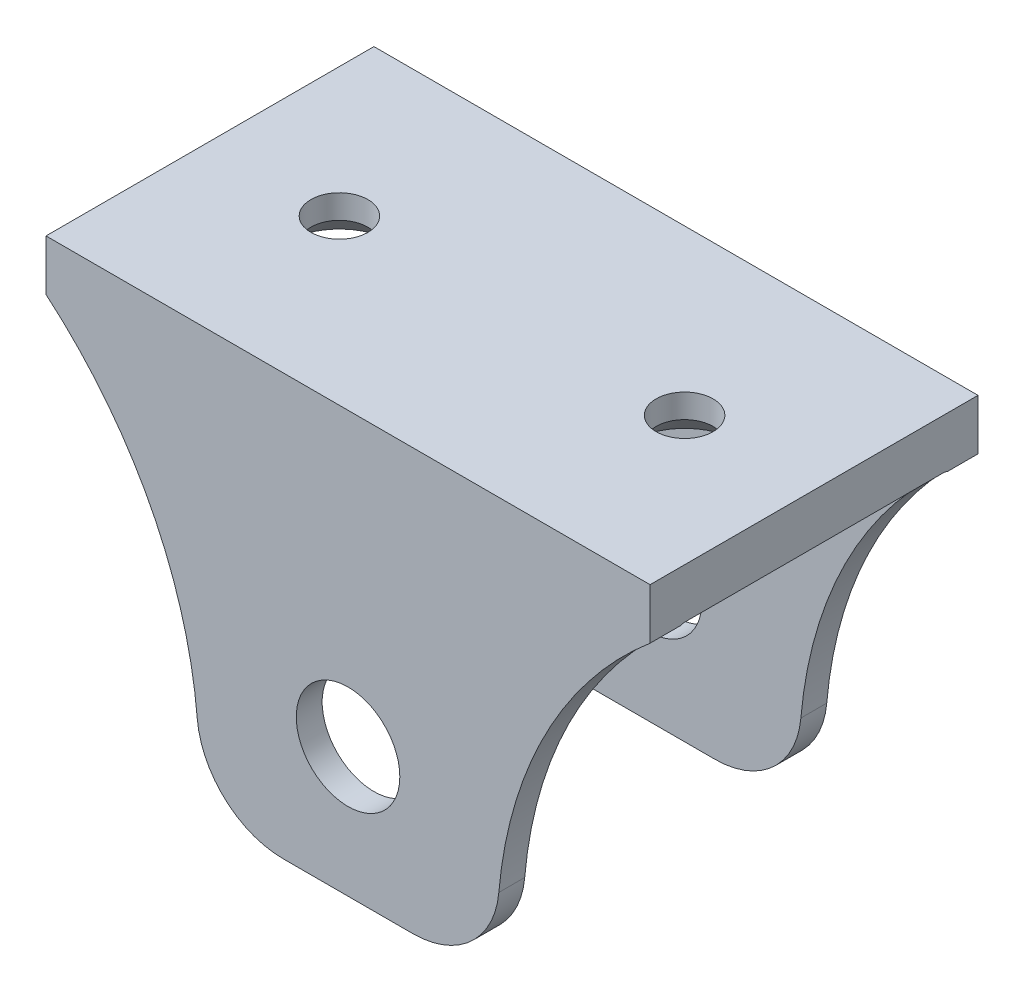
from build123d import *

# Parameters (mm, degrees)
SZKIC1_R                                 = 6
DODANIE_WYCI_GNI_CIE1_DEPTH              = 38
SZKIC2_W                                 = 70
SZKIC2_H                                 = 32
WYTNIJ_WYCI_GNI_CIE1_DEPTH               = 43
ZAOKR_GLENIE1_R                          = 1
POG_BIENIE_STO_KOWE_POD_M6_RUB_Z_2_COUNT = 2
POG_BIENIE_STO_KOWE_POD_M6_RUB_Z_2_PITCH = 40


with BuildPart() as part:
    # Szkic1 → Dodanie-wyciągnięcie1 (new body)
    with BuildSketch(Plane.XY):
        with BuildLine():
            Line((0, 48.768640881), (0, 42.89244343))
            ThreePointArc((0, 42.89244343), (12.102069866, 27.737632724), (17.527104902, 9.1178213))
            ThreePointArc((17.527104902, 9.1178213), (20.736146372, 2.623625993), (27.488116936, 0))
            Line((27.488116936, 0), (42.511883064, 0))
            ThreePointArc((42.511883064, 0), (49.263853628, 2.623625993), (52.472895098, 9.1178213))
            ThreePointArc((52.472895098, 9.1178213), (57.897930134, 27.737632724), (70, 42.89244343))
            Line((70, 42.89244343), (70, 48.768640881))
            Line((70, 48.768640881), (0, 48.768640881))
        make_face()
        with Locations((35, 15)):
            Circle(SZKIC1_R, mode=Mode.SUBTRACT)
    extrude(amount=DODANIE_WYCI_GNI_CIE1_DEPTH)

    # Szkic2 → Wytnij-wyciągnięcie1 (cut)
    with BuildSketch(Plane.XZ):
        with Locations((35, 19)):
            Rectangle(SZKIC2_W, SZKIC2_H)
    extrude(amount=-WYTNIJ_WYCI_GNI_CIE1_DEPTH, mode=Mode.SUBTRACT)

    # Zaokrąglenie1
    zaokr_glenie1_edges = [part.edges().sort_by_distance(p)[0] for p in [
        (35, 43, 35),
        (35, 43, 3),
    ]]
    fillet(zaokr_glenie1_edges, radius=ZAOKR_GLENIE1_R)

    # Szkic5 → Pogłębienie stożkowe pod M6 Śrubę z łbem soczewkowym1 (revolve, cut)
    with BuildSketch(Plane(origin=(15, 43, 19), x_dir=(0, 0, -1), z_dir=(1, 0, 0))):
        Polygon((0, 0), (0, 5.768640881), (3.3, 5.768640881), (3.3, 3), (6.3, 0), align=None)
    pog_bienie_sto_kowe_pod_m6_rub_z_bem = revolve(axis=Axis((15, 36.65, 19), (0, 1, 0)), mode=Mode.SUBTRACT)

    # Pog_bienie sto_kowe pod M6 _rub_ z _ 2: Pogłębienie stożkowe pod M6 Śrubę z łbem soczewkowym1 ×2
    with Locations(*[(i * POG_BIENIE_STO_KOWE_POD_M6_RUB_Z_2_PITCH, 0, 0) for i in range(1, POG_BIENIE_STO_KOWE_POD_M6_RUB_Z_2_COUNT)]):
        add(pog_bienie_sto_kowe_pod_m6_rub_z_bem, mode=Mode.SUBTRACT)


solid = part.part
